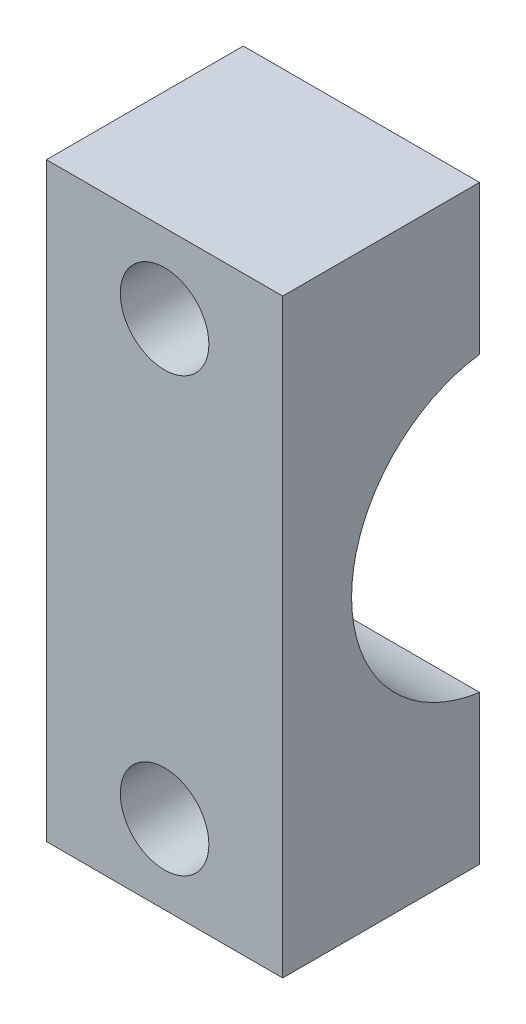
from build123d import *

# Parameters (mm, degrees)
BOSS_EXTRUDE1_DEPTH = 6
SKETCH2_R           = 2.25
CUT_EXTRUDE1_DEPTH  = 20


with BuildPart() as part:
    # Sketch1 → Boss-Extrude1 (new, symmetric)
    with BuildSketch(Plane(origin=(0, 0, 0), x_dir=(0, 0, -1), z_dir=(1, 0, 0))):
        with BuildLine():
            Line((-1, 7.433034374), (-1, 15))
            Line((-1, 15), (-11, 15))
            Line((-11, 15), (-11, -15))
            Line((-11, -15), (-1, -15))
            Line((-1, -15), (-1, -7.433034374))
            ThreePointArc((-1, -7.433034374), (-7.5, 0), (-1, 7.433034374))
        make_face()
    extrude(amount=BOSS_EXTRUDE1_DEPTH, both=True)

    # Sketch2 → Cut-Extrude1 (cut, through all)
    with BuildSketch(Plane.XY.offset(11)):
        with Locations((0, 11)):
            Circle(SKETCH2_R)
        with Locations((0, -11)):
            Circle(SKETCH2_R)
    extrude(amount=-CUT_EXTRUDE1_DEPTH, mode=Mode.SUBTRACT)


solid = part.part
